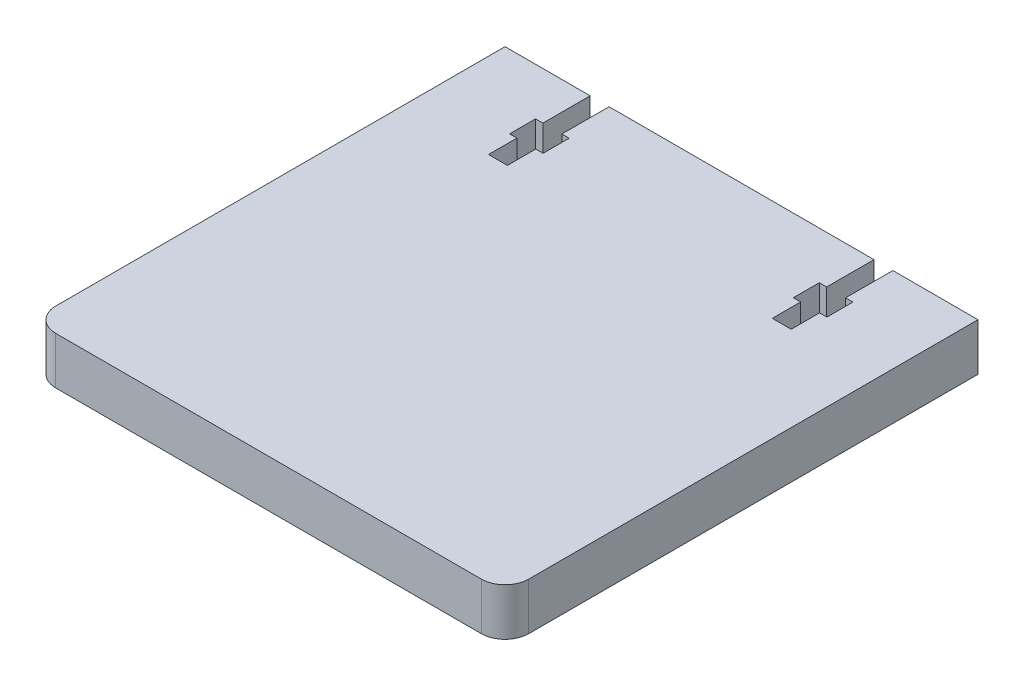
from build123d import *

# Parameters (mm, degrees)
SKETCH1_W               = 100
SKETCH1_H               = 10
BOSS_EXTRUDE1_DEPTH     = 100
ENL_V_MAT_EXTRU_1_DEPTH = 10
CONG_1_R                = 5
CONG_3_R                = 5


with BuildPart() as part:
    # Sketch1 → Boss-Extrude1 (new body)
    with BuildSketch(Plane.XY):
        with Locations((50, 5)):
            Rectangle(SKETCH1_W, SKETCH1_H)
    extrude(amount=BOSS_EXTRUDE1_DEPTH)

    # Esquisse1 → Enlèv. mat.-Extru.1 (cut)
    with BuildSketch(Plane.XZ):
        Polygon((18, 10), (18, 0), (22, 0), (22, 10), (23.55, 10), (23.55, 15.5), (22, 15.5), (22, 21.5), (18, 21.5), (18, 15.5), (16.45, 15.5), (16.45, 10), align=None)
        Polygon((78, 10), (78, 0), (82, 0), (82, 10), (83.55, 10), (83.55, 15.5), (82, 15.5), (82, 21.5), (78, 21.5), (78, 15.5), (76.45, 15.5), (76.45, 10), align=None)
    extrude(amount=-ENL_V_MAT_EXTRU_1_DEPTH, mode=Mode.SUBTRACT)

    # Congé1
    cong_1_edges = [part.edges().sort_by_distance(p)[0] for p in [
        (0, 5, 100),
    ]]
    fillet(cong_1_edges, radius=CONG_1_R)

    # Congé3
    cong_3_edges = [part.edges().sort_by_distance(p)[0] for p in [
        (100, 5, 100),
    ]]
    fillet(cong_3_edges, radius=CONG_3_R)


solid = part.part
